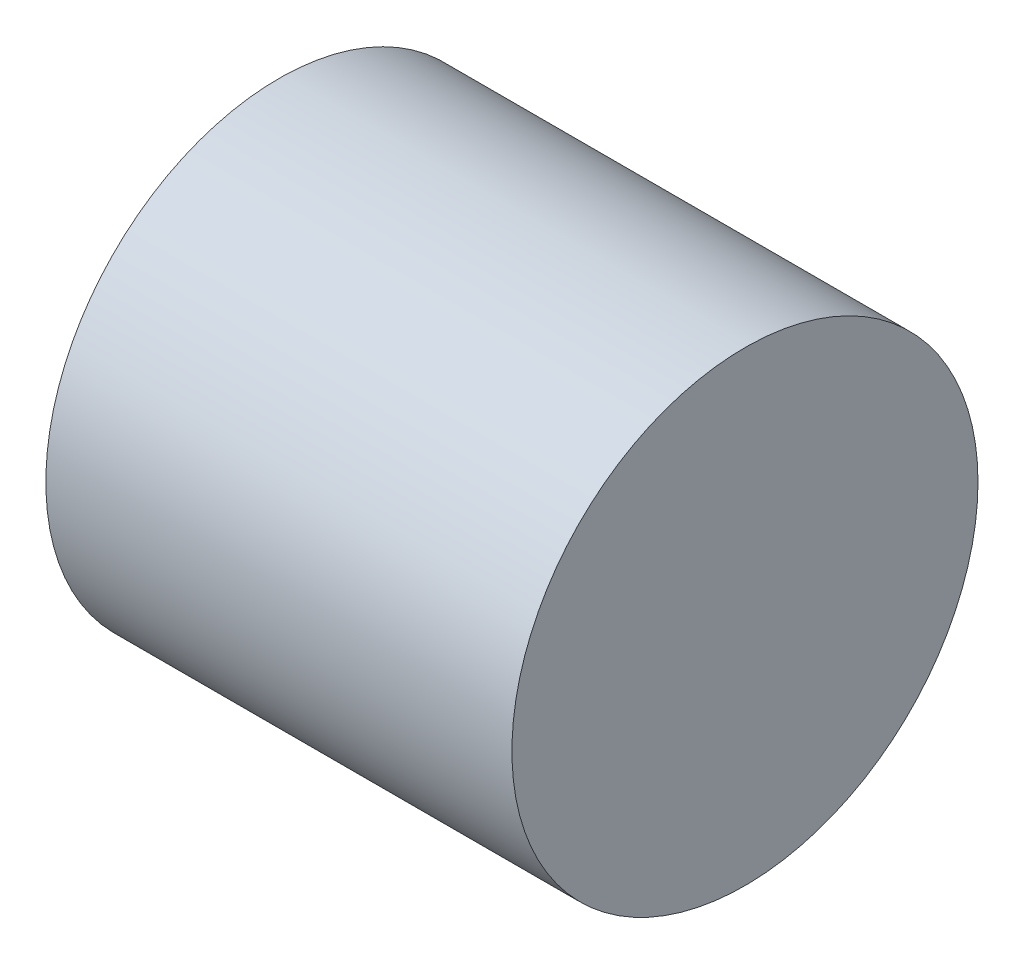
from build123d import *

# Parameters (mm, degrees)
SKETCH1_R           = 7.5
BOSS_EXTRUDE1_DEPTH = 15


with BuildPart() as part:
    # Sketch1 → Boss-Extrude1 (new body)
    with BuildSketch(Plane(origin=(0, 0, 0), x_dir=(0, 0, -1), z_dir=(1, 0, 0))):
        Circle(SKETCH1_R)
    extrude(amount=BOSS_EXTRUDE1_DEPTH)


solid = part.part
